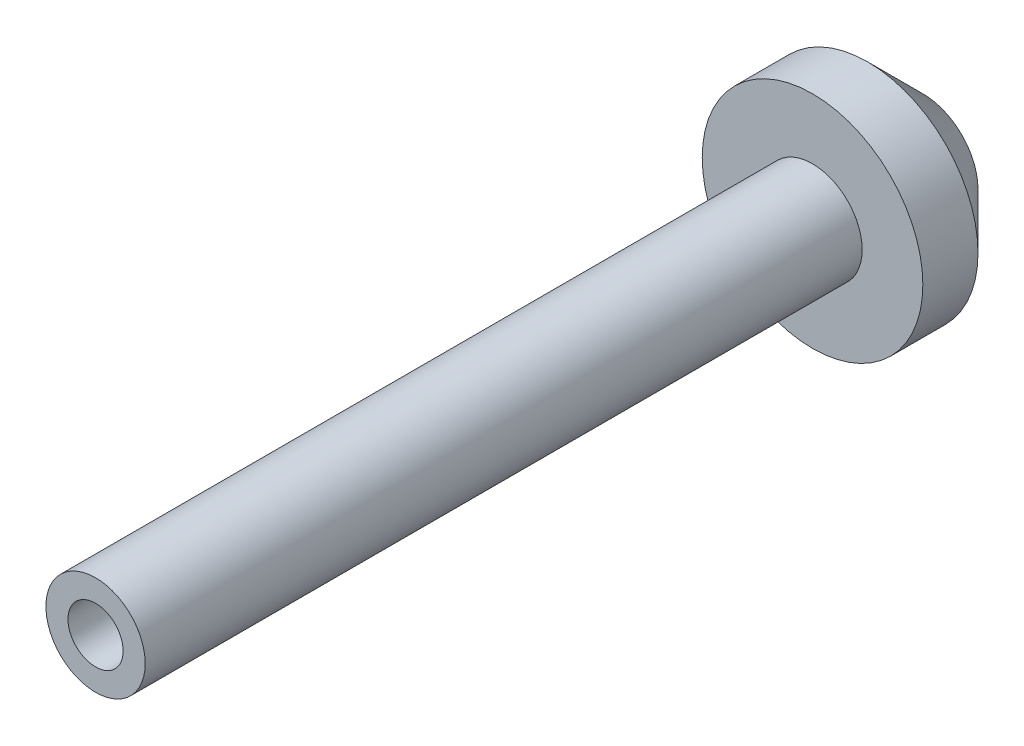
from build123d import *

# Parameters (mm, degrees)
SKETCH1_R           = 5
BOSS_EXTRUDE1_DEPTH = 5
SKETCH2_R           = 2.25
BOSS_EXTRUDE2_DEPTH = 32.5
SKETCH3_R           = 1.25
CUT_EXTRUDE1_DEPTH  = 10
CHAMFER1_SIZE       = 2.5


with BuildPart() as part:
    # Sketch1 → Boss-Extrude1 (new body)
    with BuildSketch(Plane.XY):
        Circle(SKETCH1_R)
    extrude(amount=BOSS_EXTRUDE1_DEPTH)

    # Sketch2 → Boss-Extrude2 (add)
    with BuildSketch(Plane.XY.offset(5)):
        Circle(SKETCH2_R)
    extrude(amount=BOSS_EXTRUDE2_DEPTH)

    # Sketch3 → Cut-Extrude1 (cut)
    with BuildSketch(Plane.XY.offset(37.5)):
        Circle(SKETCH3_R)
    extrude(amount=-CUT_EXTRUDE1_DEPTH, mode=Mode.SUBTRACT)

    # Chamfer1
    chamfer1_edges = [part.edges().sort_by_distance(p)[0] for p in [
        (-5, 0, 0),
    ]]
    chamfer(chamfer1_edges, length=CHAMFER1_SIZE)


solid = part.part
